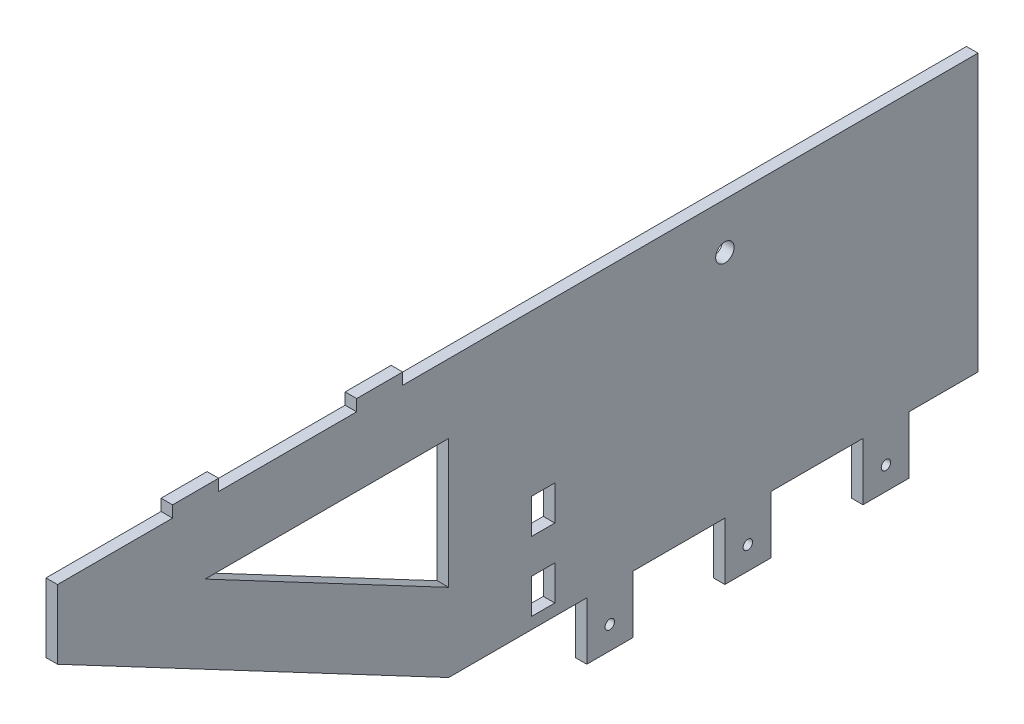
from build123d import *

# Parameters (mm, degrees)
SKETCH_1_W          = 200
SKETCH_1_H          = 120
SKETCH_1_R          = 4
EXTRUDE_1_DEPTH     = 5
SKETCH_2_W          = 20
SKETCH_2_H          = 25
SKETCH_2_R          = 2.05
EXTRUDE_2_DEPTH     = 5
EXTRUDE_3_DEPTH     = 5
SKETCH_4_W          = 10.1
SKETCH_4_H          = 15.1
CUT_EXTRUDE_1_DEPTH = 312.84932259
SKETCH_5_W          = 5
SKETCH_5_H          = 20
EXTRUDE_4_DEPTH     = 5


with BuildPart() as part:
    # 草圖1 → 填料-伸長1 (new body)
    with BuildSketch(Plane(origin=(0, 0, 0), x_dir=(0, 0, -1), z_dir=(1, 0, 0))):
        Rectangle(SKETCH_1_W, SKETCH_1_H)
        with Locations((-10, 40)):
            Circle(SKETCH_1_R, mode=Mode.SUBTRACT)
    extrude(amount=EXTRUDE_1_DEPTH)

    # 草圖2 → 填料-伸長2 (add)
    # profile 1 of 3: a face of its own
    with BuildSketch(Plane(origin=(5, 0, 0), x_dir=(0, 0, -1), z_dir=(1, 0, 0))):
        with Locations((-60, -72.5)):
            Rectangle(SKETCH_2_W, SKETCH_2_H)
        with Locations((-60, -75)):
            Circle(SKETCH_2_R, mode=Mode.SUBTRACT)
    # profile 2 of 3: a face of its own
    with BuildSketch(Plane(origin=(5, 0, 0), x_dir=(0, 0, -1), z_dir=(1, 0, 0))):
        with Locations((0, -72.5)):
            Rectangle(SKETCH_2_W, SKETCH_2_H)
        with Locations((0, -75)):
            Circle(SKETCH_2_R, mode=Mode.SUBTRACT)
    # profile 3 of 3: a face of its own
    with BuildSketch(Plane(origin=(5, 0, 0), x_dir=(0, 0, -1), z_dir=(1, 0, 0))):
        with Locations((60, -72.5)):
            Rectangle(SKETCH_2_W, SKETCH_2_H)
        with Locations((60, -75)):
            Circle(SKETCH_2_R, mode=Mode.SUBTRACT)
    extrude(amount=-EXTRUDE_2_DEPTH)

    # 草圖3 → 填料-伸長3 (add)
    with BuildSketch(Plane(origin=(5, 0, 0), x_dir=(0, 0, -1), z_dir=(1, 0, 0))):
        Polygon((-100, 60), (-300, 60), (-300, 30), (-130, -60), (-100, -60), align=None)
        Polygon((-130, 30), (-130, -26.055204597), (-235.882053128, 30), align=None, mode=Mode.SUBTRACT)
    extrude(amount=-EXTRUDE_3_DEPTH)

    # 草圖4 → 除料-伸長1 (cut, through all)
    with BuildSketch(Plane(origin=(5, 0, 0), x_dir=(0, 0, -1), z_dir=(1, 0, 0))):
        with Locations((-88.95, -17.35)):
            Rectangle(SKETCH_4_W, SKETCH_4_H)
        with Locations((-88.95, -47.45)):
            Rectangle(SKETCH_4_W, SKETCH_4_H)
    extrude(amount=-CUT_EXTRUDE_1_DEPTH, mode=Mode.SUBTRACT)

    # 草圖5 → 填料-伸長4 (add)
    with BuildSketch(Plane(origin=(0, 60, 0), x_dir=(1, 0, 0), z_dir=(0, 1, 0))):
        with Locations((2.5, -160)):
            Rectangle(SKETCH_5_W, SKETCH_5_H)
        with Locations((2.5, -240)):
            Rectangle(SKETCH_5_W, SKETCH_5_H)
    extrude(amount=EXTRUDE_4_DEPTH)


solid = part.part
